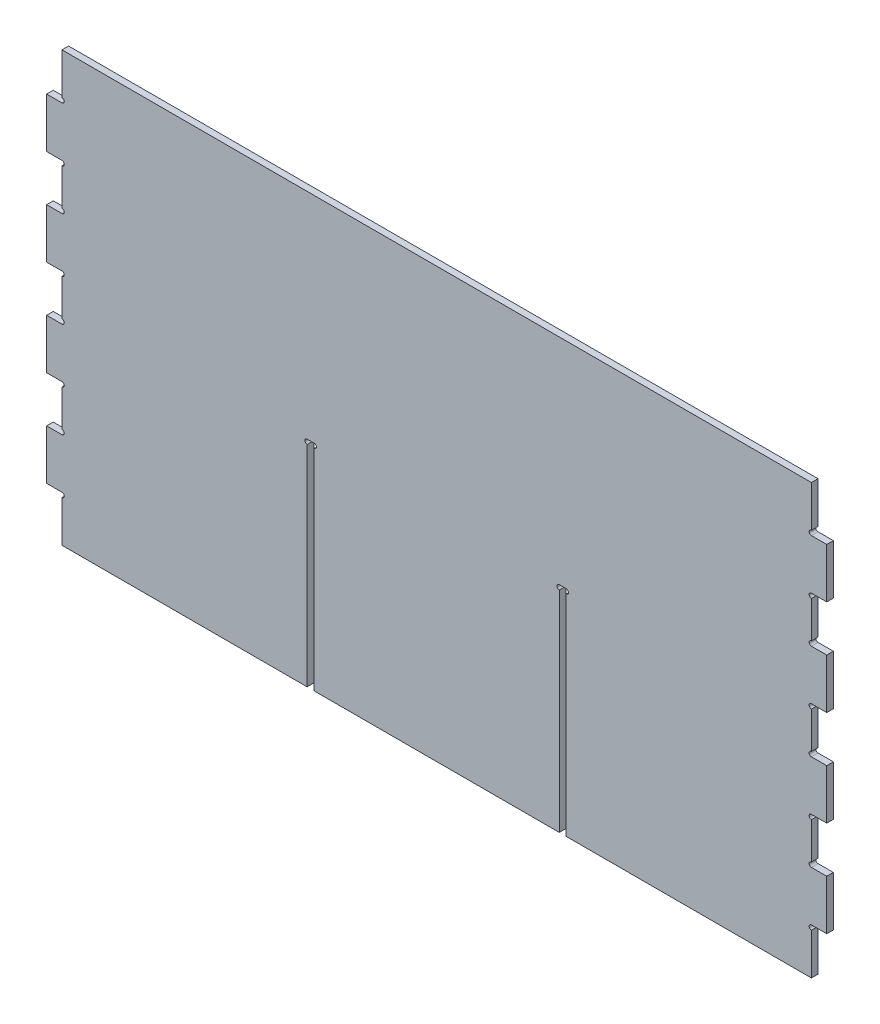
from build123d import *

# Parameters (mm, degrees)
SKETCH1_W           = 646.4808
SKETCH1_H           = 355.6
BOSS_EXTRUDE1_DEPTH = 5.4864
CUT_EXTRUDE1_DEPTH  = 738.847467539
CUT_EXTRUDE2_DEPTH  = 738.847467539


with BuildPart() as part:
    # Sketch1 → Boss-Extrude1 (new body)
    with BuildSketch(Plane.XY):
        with Locations((323.2404, 177.8)):
            Rectangle(SKETCH1_W, SKETCH1_H)
    extrude(amount=BOSS_EXTRUDE1_DEPTH)

    # Sketch4 → Cut-Extrude1 (cut, through all)
    with BuildSketch(Plane.XY.offset(5.4864)):
        with BuildLine():
            Line((424.8404, 177.8), (430.5808, 177.8))
            ThreePointArc((430.5808, 177.8), (432.4858, 175.895), (430.5808, 173.99))
            Line((430.5808, 173.99), (430.5808, 0))
            Line((430.5808, 0), (424.8404, 0))
            Line((424.8404, 0), (424.8404, 173.99))
            ThreePointArc((424.8404, 173.99), (422.9354, 175.895), (424.8404, 177.8))
        make_face()
        with BuildLine():
            Line((215.9, 177.8), (221.6404, 177.8))
            ThreePointArc((221.6404, 177.8), (223.5454, 175.895), (221.6404, 173.99))
            Line((221.6404, 173.99), (221.6404, 0))
            Line((221.6404, 0), (215.9, 0))
            Line((215.9, 0), (215.9, 173.99))
            ThreePointArc((215.9, 173.99), (213.995, 175.895), (215.9, 177.8))
        make_face()
    extrude(amount=-CUT_EXTRUDE1_DEPTH, mode=Mode.SUBTRACT)

    # Sketch5 → Cut-Extrude2 (cut, through all)
    with BuildSketch(Plane.XY.offset(5.4864)):
        with BuildLine():
            Line((0, 0), (12.7, 0))
            Line((12.7, 0), (12.7, 3.81))
            Line((12.7, 3.81), (12.7, 34.29))
            ThreePointArc((12.7, 34.29), (14.605, 36.195), (12.7, 38.1))
            Line((12.7, 38.1), (0, 38.1))
            ThreePointArc((0, 38.1), (-1.905, 36.195), (0, 34.29))
            Line((0, 34.29), (0, 3.81))
            ThreePointArc((0, 3.81), (-1.905, 1.905), (0, 0))
        make_face()
        with BuildLine():
            Line((0, 117.475), (12.7, 117.475))
            ThreePointArc((12.7, 117.475), (14.605, 115.57), (12.7, 113.665))
            Line((12.7, 113.665), (12.7, 83.185))
            ThreePointArc((12.7, 83.185), (14.605, 81.28), (12.7, 79.375))
            Line((12.7, 79.375), (0, 79.375))
            ThreePointArc((0, 79.375), (-1.905, 81.28), (0, 83.185))
            Line((0, 83.185), (0, 113.665))
            ThreePointArc((0, 113.665), (-1.905, 115.57), (0, 117.475))
        make_face()
        with BuildLine():
            Line((0, 196.85), (12.7, 196.85))
            ThreePointArc((12.7, 196.85), (14.605, 194.945), (12.7, 193.04))
            Line((12.7, 193.04), (12.7, 162.56))
            ThreePointArc((12.7, 162.56), (14.605, 160.655), (12.7, 158.75))
            Line((12.7, 158.75), (0, 158.75))
            ThreePointArc((0, 158.75), (-1.905, 160.655), (0, 162.56))
            Line((0, 162.56), (0, 193.04))
            ThreePointArc((0, 193.04), (-1.905, 194.945), (0, 196.85))
        make_face()
        with BuildLine():
            Line((0, 276.225), (12.7, 276.225))
            ThreePointArc((12.7, 276.225), (14.605, 274.32), (12.7, 272.415))
            Line((12.7, 272.415), (12.7, 241.935))
            ThreePointArc((12.7, 241.935), (14.605, 240.03), (12.7, 238.125))
            Line((12.7, 238.125), (0, 238.125))
            ThreePointArc((0, 238.125), (-1.905, 240.03), (0, 241.935))
            Line((0, 241.935), (0, 272.415))
            ThreePointArc((0, 272.415), (-1.905, 274.32), (0, 276.225))
        make_face()
        with BuildLine():
            Line((0, 355.6), (12.7, 355.6))
            Line((12.7, 355.6), (12.7, 351.79))
            Line((12.7, 351.79), (12.7, 321.31))
            ThreePointArc((12.7, 321.31), (14.605, 319.405), (12.7, 317.5))
            Line((12.7, 317.5), (0, 317.5))
            ThreePointArc((0, 317.5), (-1.905, 319.405), (0, 321.31))
            Line((0, 321.31), (0, 351.79))
            ThreePointArc((0, 351.79), (-1.905, 353.695), (0, 355.6))
        make_face()
        with BuildLine():
            Line((646.4808, 321.31), (646.4808, 351.79))
            ThreePointArc((646.4808, 351.79), (648.3858, 353.695), (646.4808, 355.6))
            Line((646.4808, 355.6), (633.7808, 355.6))
            Line((633.7808, 355.6), (633.7808, 351.79))
            Line((633.7808, 351.79), (633.7808, 321.31))
            ThreePointArc((633.7808, 321.31), (631.8758, 319.405), (633.7808, 317.5))
            Line((633.7808, 317.5), (646.4808, 317.5))
            ThreePointArc((646.4808, 317.5), (648.3858, 319.405), (646.4808, 321.31))
        make_face()
        with BuildLine():
            Line((646.4808, 241.935), (646.4808, 272.415))
            ThreePointArc((646.4808, 272.415), (648.3858, 274.32), (646.4808, 276.225))
            Line((646.4808, 276.225), (633.7808, 276.225))
            ThreePointArc((633.7808, 276.225), (631.8758, 274.32), (633.7808, 272.415))
            Line((633.7808, 272.415), (633.7808, 241.935))
            ThreePointArc((633.7808, 241.935), (631.8758, 240.03), (633.7808, 238.125))
            Line((633.7808, 238.125), (646.4808, 238.125))
            ThreePointArc((646.4808, 238.125), (648.3858, 240.03), (646.4808, 241.935))
        make_face()
        with BuildLine():
            Line((646.4808, 162.56), (646.4808, 193.04))
            ThreePointArc((646.4808, 193.04), (648.3858, 194.945), (646.4808, 196.85))
            Line((646.4808, 196.85), (633.7808, 196.85))
            ThreePointArc((633.7808, 196.85), (631.8758, 194.945), (633.7808, 193.04))
            Line((633.7808, 193.04), (633.7808, 162.56))
            ThreePointArc((633.7808, 162.56), (631.8758, 160.655), (633.7808, 158.75))
            Line((633.7808, 158.75), (646.4808, 158.75))
            ThreePointArc((646.4808, 158.75), (648.3858, 160.655), (646.4808, 162.56))
        make_face()
        with BuildLine():
            Line((646.4808, 83.185), (646.4808, 113.665))
            ThreePointArc((646.4808, 113.665), (648.3858, 115.57), (646.4808, 117.475))
            Line((646.4808, 117.475), (633.7808, 117.475))
            ThreePointArc((633.7808, 117.475), (631.8758, 115.57), (633.7808, 113.665))
            Line((633.7808, 113.665), (633.7808, 83.185))
            ThreePointArc((633.7808, 83.185), (631.8758, 81.28), (633.7808, 79.375))
            Line((633.7808, 79.375), (646.4808, 79.375))
            ThreePointArc((646.4808, 79.375), (648.3858, 81.28), (646.4808, 83.185))
        make_face()
        with BuildLine():
            Line((633.7808, 3.81), (633.7808, 34.29))
            ThreePointArc((633.7808, 34.29), (631.8758, 36.195), (633.7808, 38.1))
            Line((633.7808, 38.1), (646.4808, 38.1))
            ThreePointArc((646.4808, 38.1), (648.3858, 36.195), (646.4808, 34.29))
            Line((646.4808, 34.29), (646.4808, 3.81))
            ThreePointArc((646.4808, 3.81), (648.3858, 1.905), (646.4808, 0))
            Line((646.4808, 0), (633.7808, 0))
            Line((633.7808, 0), (633.7808, 3.81))
        make_face()
    extrude(amount=-CUT_EXTRUDE2_DEPTH, mode=Mode.SUBTRACT)


solid = part.part
